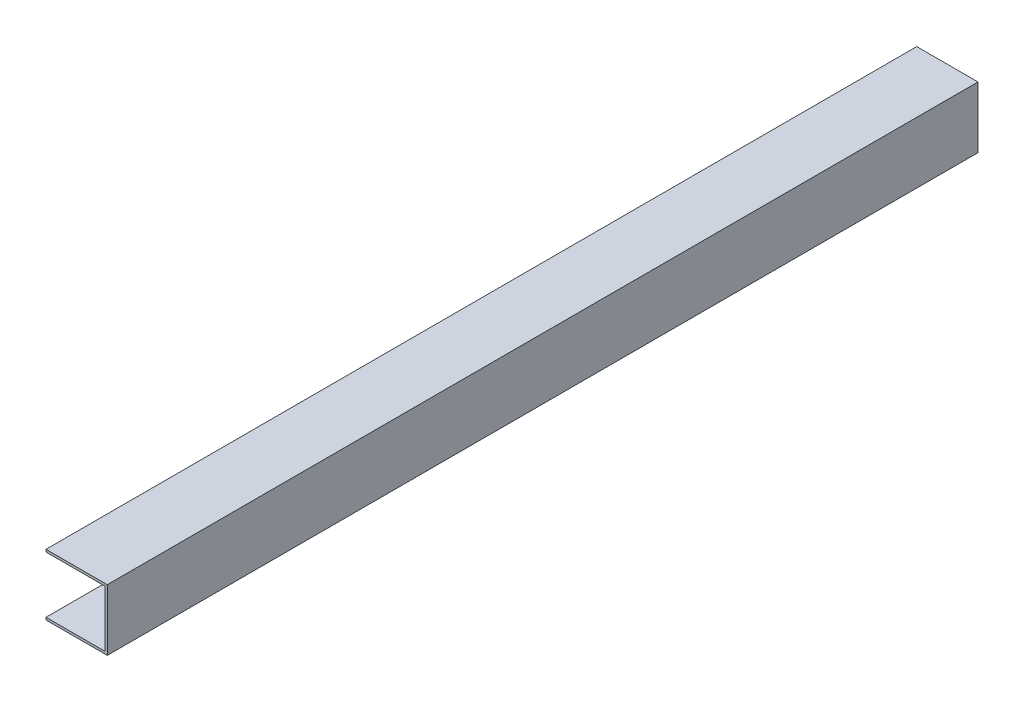
from build123d import *

# Parameters (mm, degrees)
CROQUIS1_W              = 25.4
CROQUIS1_H              = 25.4
CROQUIS1_W_2            = 23.4
CROQUIS1_H_2            = 23.4
SALIENTE_EXTRUIR1_DEPTH = 361
CROQUIS2_W              = 50
CROQUIS2_H              = 23.4
CORTAR_EXTRUIR1_DEPTH   = 1
CORTAR_EXTRUIR2_REACH   = 364.783
CROQUIS3_W              = 11
CROQUIS3_H              = 23.4


with BuildPart() as part:
    # Croquis1 → Saliente-Extruir1 (new body)
    with BuildSketch(Plane.XY):
        with Locations((-12.7, -12.7)):
            Rectangle(CROQUIS1_W, CROQUIS1_H)
        with Locations((-12.7, -12.7)):
            Rectangle(CROQUIS1_W_2, CROQUIS1_H_2, mode=Mode.SUBTRACT)
    extrude(amount=SALIENTE_EXTRUIR1_DEPTH)

    # Croquis2 → Cortar-Extruir1 (cut)
    with BuildSketch(Plane.ZY.offset(25.4)):
        with Locations((336, -12.7)):
            Rectangle(CROQUIS2_W, CROQUIS2_H)
        with Locations((25, -12.7)):
            Rectangle(CROQUIS2_W, CROQUIS2_H)
    extrude(amount=-CORTAR_EXTRUIR1_DEPTH, mode=Mode.SUBTRACT)

    # Croquis3 → Cortar-Extruir2 (cut, up to next)
    with BuildSketch(Plane.ZY.offset(25.4), mode=Mode.PRIVATE) as cortar_extruir2_sk1:
        with Locations((55.5, -12.7)):
            Rectangle(CROQUIS3_W, CROQUIS3_H)
    cortar_extruir2_tool1 = extrude(cortar_extruir2_sk1.sketch, amount=-CORTAR_EXTRUIR2_REACH, mode=Mode.PRIVATE) & part.part
    add(cortar_extruir2_tool1.solids().sort_by_distance((-25.4, -12.7, 55.5))[0], mode=Mode.SUBTRACT)


solid = part.part
